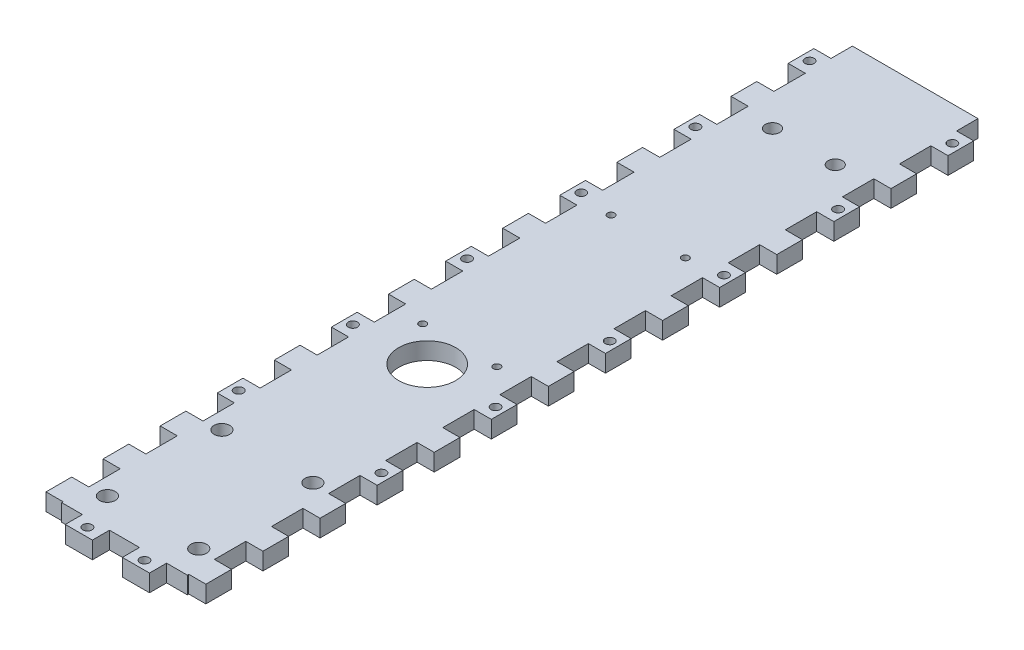
from build123d import *

# Parameters (mm, degrees)
SKETCH1_W               = 44
SKETCH1_H               = 6
BOSS_EXTRUDE1_DEPTH     = 277
SKETCH4_W               = 9
SKETCH4_H               = 6
BOSS_EXTRUDE2_DEPTH     = 6
SKETCH5_W               = 9
SKETCH5_H               = 6
BOSS_EXTRUDE3_DEPTH     = 6
SKETCH6_W               = 9.5
SKETCH6_H               = 6
BOSS_EXTRUDE4_DEPTH     = 6
SKETCH7_R               = 1.6
CUT_EXTRUDE1_DEPTH      = 286.346184868
SKETCH8_R               = 2.5
CUT_EXTRUDE2_DEPTH      = 12
SKETCH9_R               = 1.6
CUT_EXTRUDE3_DEPTH      = 12
CUT_EXTRUDE4_DEPTH      = 286.346184868
CUT_EXTRUDE4_DEPTH_BACK = 286.346184868
SKETCH11_R              = 2.75
SKETCH7_2_R             = 1.6
BOSS_EXTRUDE5_DEPTH     = 6
BOSS_EXTRUDE5_2_DEPTH   = 6
SKETCH12_R              = 1.25
SKETCH12_R_2            = 10
CUT_EXTRUDE5_DEPTH      = 286.346184868


with BuildPart() as part:
    # Sketch1 → Boss-Extrude1 (new body)
    with BuildSketch(Plane.XY):
        with Locations((-8.02006689, 7.52173913)):
            Rectangle(SKETCH1_W, SKETCH1_H)
    extrude(amount=BOSS_EXTRUDE1_DEPTH)

    # Sketch4 → Boss-Extrude2 (add)
    with BuildSketch(Plane(origin=(13.97993311, 0, 0), x_dir=(0, 0, -1), z_dir=(1, 0, 0))):
        with Locations((-272, 7.52173913)):
            Rectangle(SKETCH4_W, SKETCH4_H)
        with Locations((-252, 7.52173913)):
            Rectangle(SKETCH4_W, SKETCH4_H)
        with Locations((-232, 7.52173913)):
            Rectangle(SKETCH4_W, SKETCH4_H)
        with Locations((-212, 7.52173913)):
            Rectangle(SKETCH4_W, SKETCH4_H)
        with Locations((-192, 7.52173913)):
            Rectangle(SKETCH4_W, SKETCH4_H)
        with Locations((-172, 7.52173913)):
            Rectangle(SKETCH4_W, SKETCH4_H)
        with Locations((-152, 7.52173913)):
            Rectangle(SKETCH4_W, SKETCH4_H)
        with Locations((-132, 7.52173913)):
            Rectangle(SKETCH4_W, SKETCH4_H)
        with Locations((-112, 7.52173913)):
            Rectangle(SKETCH4_W, SKETCH4_H)
        with Locations((-92, 7.52173913)):
            Rectangle(SKETCH4_W, SKETCH4_H)
        with Locations((-72, 7.52173913)):
            Rectangle(SKETCH4_W, SKETCH4_H)
        with Locations((-52, 7.52173913)):
            Rectangle(SKETCH4_W, SKETCH4_H)
        with Locations((-32, 7.52173913)):
            Rectangle(SKETCH4_W, SKETCH4_H)
        with Locations((-12, 7.52173913)):
            Rectangle(SKETCH4_W, SKETCH4_H)
    extrude(amount=BOSS_EXTRUDE2_DEPTH)

    # Sketch5 → Boss-Extrude3 (add)
    with BuildSketch(Plane.ZY.offset(30.02006689)):
        with Locations((272, 7.52173913)):
            Rectangle(SKETCH5_W, SKETCH5_H)
        with Locations((252, 7.52173913)):
            Rectangle(SKETCH5_W, SKETCH5_H)
        with Locations((232, 7.52173913)):
            Rectangle(SKETCH5_W, SKETCH5_H)
        with Locations((212, 7.52173913)):
            Rectangle(SKETCH5_W, SKETCH5_H)
        with Locations((192, 7.52173913)):
            Rectangle(SKETCH5_W, SKETCH5_H)
        with Locations((172, 7.52173913)):
            Rectangle(SKETCH5_W, SKETCH5_H)
        with Locations((152, 7.52173913)):
            Rectangle(SKETCH5_W, SKETCH5_H)
        with Locations((132, 7.52173913)):
            Rectangle(SKETCH5_W, SKETCH5_H)
        with Locations((112, 7.52173913)):
            Rectangle(SKETCH5_W, SKETCH5_H)
        with Locations((92, 7.52173913)):
            Rectangle(SKETCH5_W, SKETCH5_H)
        with Locations((72, 7.52173913)):
            Rectangle(SKETCH5_W, SKETCH5_H)
        with Locations((52, 7.52173913)):
            Rectangle(SKETCH5_W, SKETCH5_H)
        with Locations((32, 7.52173913)):
            Rectangle(SKETCH5_W, SKETCH5_H)
        with Locations((12, 7.52173913)):
            Rectangle(SKETCH5_W, SKETCH5_H)
    extrude(amount=BOSS_EXTRUDE3_DEPTH)

    # Sketch6 → Boss-Extrude4 (add)
    with BuildSketch(Plane.XY.offset(277)):
        with Locations((-18.02006689, 7.52173913)):
            Rectangle(SKETCH6_W, SKETCH6_H)
        with Locations((1.97993311, 7.52173913)):
            Rectangle(SKETCH6_W, SKETCH6_H)
    extrude(amount=BOSS_EXTRUDE4_DEPTH)

    # Sketch7 → Cut-Extrude1 (cut, through all)
    with BuildSketch(Plane.XZ.offset(-4.52173913)):
        with Locations(Location((16.97993311, 252, 0), (0, 0, 270))):
            Circle(SKETCH7_R)
        with Locations(Location((-33.02006689, 252, 0), (0, 0, 90))):
            Circle(SKETCH7_R)
        with Locations(Location((-33.02006689, 212, 0), (0, 0, 90))):
            Circle(SKETCH7_R)
        with Locations(Location((16.97993311, 212, 0), (0, 0, 270))):
            Circle(SKETCH7_R)
        with Locations(Location((-33.02006689, 172, 0), (0, 0, 90))):
            Circle(SKETCH7_R)
        with Locations(Location((16.97993311, 172, 0), (0, 0, 270))):
            Circle(SKETCH7_R)
        with Locations(Location((-33.02006689, 132, 0), (0, 0, 90))):
            Circle(SKETCH7_R)
        with Locations(Location((16.97993311, 132, 0), (0, 0, 270))):
            Circle(SKETCH7_R)
        with Locations(Location((-33.02006689, 92, 0), (0, 0, 90))):
            Circle(SKETCH7_R)
        with Locations(Location((16.97993311, 92, 0), (0, 0, 270))):
            Circle(SKETCH7_R)
        with Locations(Location((-33.02006689, 52, 0), (0, 0, 90))):
            Circle(SKETCH7_R)
        with Locations(Location((16.97993311, 52, 0), (0, 0, 270))):
            Circle(SKETCH7_R)
        with Locations(Location((-33.02006689, 12, 0), (0, 0, 90))):
            Circle(SKETCH7_R)
        with Locations(Location((16.97993311, 12, 0), (0, 0, 270))):
            Circle(SKETCH7_R)
    extrude(amount=-CUT_EXTRUDE1_DEPTH, mode=Mode.SUBTRACT)

    # Sketch8 → Cut-Extrude2 (cut)
    with BuildSketch(Plane.XZ.offset(-4.52173913)):
        with Locations(Location((-19.02006689, 39, 0), (0, 0, 270))):
            Circle(SKETCH8_R)
        with Locations(Location((2.97993311, 39, 0), (0, 0, 270))):
            Circle(SKETCH8_R)
    extrude(amount=-CUT_EXTRUDE2_DEPTH, mode=Mode.SUBTRACT)

    # Sketch9 → Cut-Extrude3 (cut)
    with BuildSketch(Plane(origin=(0, 4.52173913, 0), x_dir=(-1, 0, 0), z_dir=(0, -1, 0))):
        with Locations(Location((18.02006689, -280, 0), (0, 0, 90))):
            Circle(SKETCH9_R)
        with Locations(Location((-1.97993311, -280, 0), (0, 0, 90))):
            Circle(SKETCH9_R)
    extrude(amount=-CUT_EXTRUDE3_DEPTH, mode=Mode.SUBTRACT)

    # Sketch11 → Cut-Extrude4 (cut, two sides: drawn at the far end of the back side and taken through both)
    with BuildSketch(Plane.XZ.offset(-4.52173913).offset(-CUT_EXTRUDE4_DEPTH_BACK)):
        with Locations(Location((-24.019868524, 226.88732643, 0), (0, 0, 270))):
            Circle(SKETCH11_R)
        with Locations(Location((7.97993311, 227, 0), (0, 0, 270))):
            Circle(SKETCH11_R)
        with Locations(Location((7.97993311, 267, 0), (0, 0, 270))):
            Circle(SKETCH11_R)
        with Locations(Location((-24.02006689, 267, 0), (0, 0, 270))):
            Circle(SKETCH11_R)
    extrude(amount=CUT_EXTRUDE4_DEPTH + CUT_EXTRUDE4_DEPTH_BACK, mode=Mode.SUBTRACT)


with BuildPart() as body_2:
    # Sketch7<2> → Boss-Extrude5 (new, through all)
    with BuildSketch(Plane.XZ.offset(-4.52173913)):
        with Locations(Location((16.97993311, 252, 0), (0, 0, 270))):
            Circle(SKETCH7_2_R)
    extrude(amount=-BOSS_EXTRUDE5_DEPTH)


with BuildPart() as body_3:
    # Sketch7<2> → Boss-Extrude5 2 (new, through all)
    with BuildSketch(Plane.XZ.offset(-4.52173913)):
        with Locations(Location((-33.02006689, 252, 0), (0, 0, 90))):
            Circle(SKETCH7_2_R)
    extrude(amount=-BOSS_EXTRUDE5_2_DEPTH)


with BuildPart() as part_1:
    add(part.part)

    # Combine1: union body 3, body 2
    add(body_3.part)
    add(body_2.part)

    # Sketch12 → Cut-Extrude5 (cut, through all)
    with BuildSketch(Plane(origin=(0, 10.52173913, 0), x_dir=(1, 0, 0), z_dir=(0, 1, 0))):
        with Locations(Location((4.97993311, -159.533243973, 0), (0, 0, 270))):
            Circle(SKETCH12_R)
        with Locations(Location((-21.02006689, -159.533243973, 0), (0, 0, 270))):
            Circle(SKETCH12_R)
        with Locations(Location((-21.02006689, -93.533243973, 0), (0, 0, 270))):
            Circle(SKETCH12_R)
        with Locations(Location((4.97993311, -93.533243973, 0), (0, 0, 270))):
            Circle(SKETCH12_R)
        with Locations(Location((-8.02006689, -170.956644726, 0), (0, 0, 270))):
            Circle(SKETCH12_R_2)
    extrude(amount=-CUT_EXTRUDE5_DEPTH, mode=Mode.SUBTRACT)


solid = part_1.part
